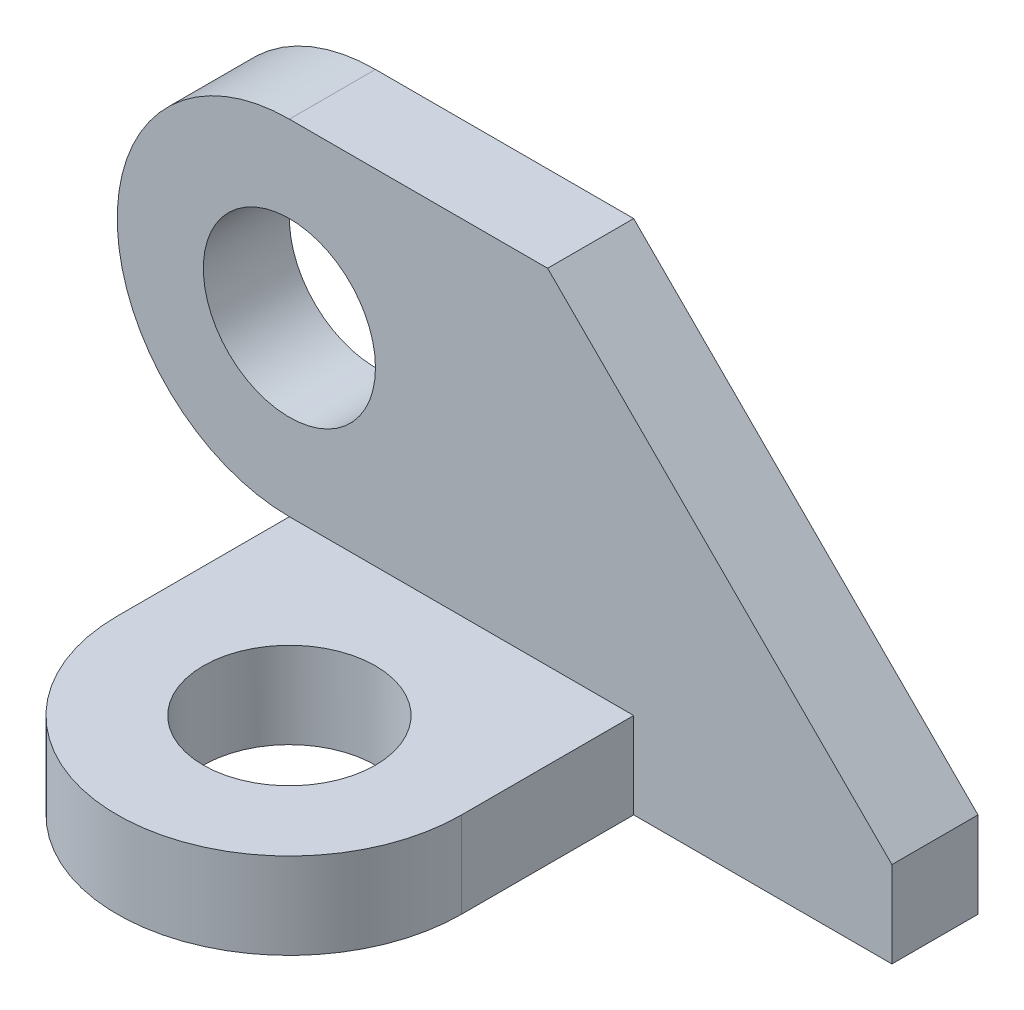
from build123d import *

# Parameters (mm, degrees)
SKETCH_2_R      = 5
EXTRUDE_3_DEPTH = 5
SKETCH_4_R      = 5
EXTRUDE_4_DEPTH = 5
SKETCH_5_W      = 20
SKETCH_5_H      = 5
EXTRUDE_5_DEPTH = 5


with BuildPart() as part:
    # 草圖2 → 填料-伸長3 (new body)
    with BuildSketch(Plane.XY):
        with BuildLine():
            Line((0, 10), (15, 10))
            Line((15, 10), (35, -10))
            Line((35, -10), (35, -15))
            Line((35, -15), (20, -15))
            Line((20, -15), (20, -10))
            Line((20, -10), (0, -10))
            ThreePointArc((0, -10), (-10, 0), (0, 10))
        make_face()
        Circle(SKETCH_2_R, mode=Mode.SUBTRACT)
    extrude(amount=EXTRUDE_3_DEPTH)



with BuildPart() as body_2:
    # 草圖4 → 填料-伸長4 (new body)
    with BuildSketch(Plane.XZ.offset(10)):
        with BuildLine():
            Line((0, 0), (0, 15))
            ThreePointArc((0, 15), (10, 25), (20, 15))
            Line((20, 15), (20, 0))
            Line((20, 0), (0, 0))
        make_face()
        with Locations(Location((10, 15, 0), (0, 0, 90))):
            Circle(SKETCH_4_R, mode=Mode.SUBTRACT)
    extrude(amount=EXTRUDE_4_DEPTH)


with BuildPart() as part_1:
    add(part.part)

    add(body_2.part)  # 填料-伸長5 merges body 2
    # 草圖5 → 填料-伸長5 (add)
    with BuildSketch(Plane.XZ.offset(15)):
        with Locations((10, 2.5)):
            Rectangle(SKETCH_5_W, SKETCH_5_H)
    extrude(amount=-EXTRUDE_5_DEPTH)


solid = part_1.part
